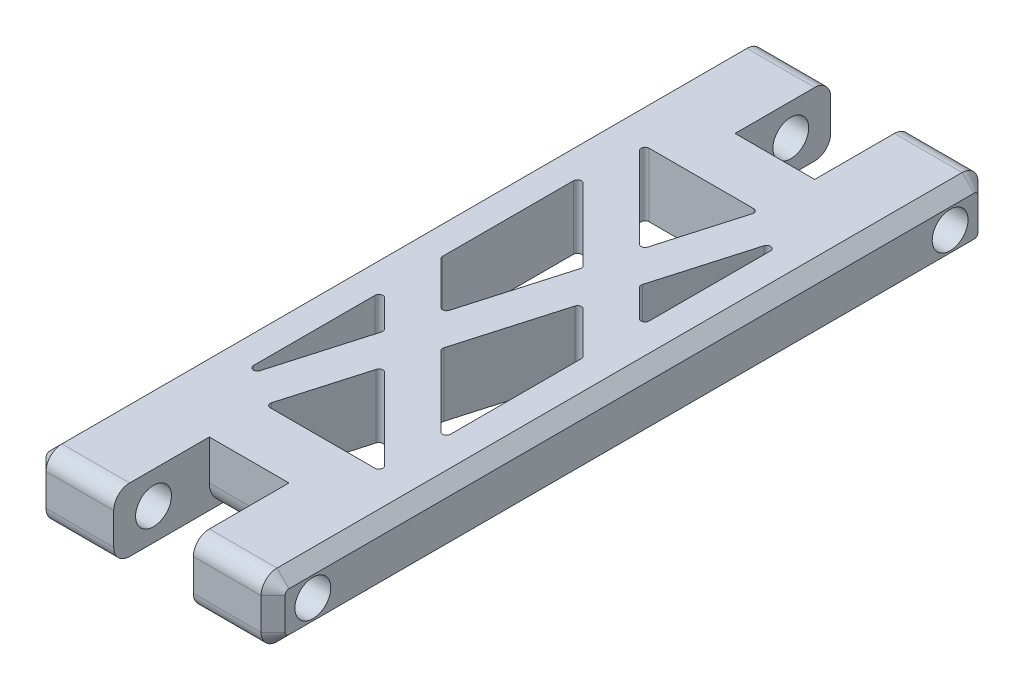
from build123d import *

# Parameters (mm, degrees)
SKETCH1_W           = 30
SKETCH1_H           = 90
BOSS_EXTRUDE1_DEPTH = 8
SKETCH2_W           = 10
SKETCH2_H           = 12
CUT_EXTRUDE1_DEPTH  = 8
SKETCH3_R           = 2.25
CUT_EXTRUDE2_DEPTH  = 55.671747731
FILLET1_R           = 2
CUT_EXTRUDE3_DEPTH  = 49.104053883
FILLET2_R           = 3
CHAMFER1_SIZE       = 1.5
FILLET3_R           = 0.5


with BuildPart() as part:
    # Sketch1 → Boss-Extrude1 (new body)
    with BuildSketch(Plane(origin=(0, 0, 0), x_dir=(1, 0, 0), z_dir=(0, 1, 0))):
        Rectangle(SKETCH1_W, SKETCH1_H)
    extrude(amount=BOSS_EXTRUDE1_DEPTH)

    # Sketch2 → Cut-Extrude1 (cut)
    with BuildSketch(Plane(origin=(0, 8, 0), x_dir=(1, 0, 0), z_dir=(0, 1, 0))):
        with Locations((0, 39)):
            Rectangle(SKETCH2_W, SKETCH2_H)
        with Locations((0, -39)):
            Rectangle(SKETCH2_W, SKETCH2_H)
    extrude(amount=-CUT_EXTRUDE1_DEPTH, mode=Mode.SUBTRACT)

    # Sketch3 → Cut-Extrude2 (cut, through all)
    with BuildSketch(Plane(origin=(15, 0, 0), x_dir=(0, 0, -1), z_dir=(1, 0, 0))):
        with Locations((-40, 4)):
            Circle(SKETCH3_R)
    cut_extrude2 = extrude(amount=-CUT_EXTRUDE2_DEPTH, mode=Mode.SUBTRACT)

    # Mirror1: Cut-Extrude2 across plane
    add(cut_extrude2.mirror(Plane.XY), mode=Mode.SUBTRACT)

    # Fillet1
    fillet1_edges = [part.edges().sort_by_distance(p)[0] for p in [
        (10, 0, 45),
        (-10, 0, -45),
        (-10, 8, 45),
        (-10, 8, -45),
        (10, 8, 45),
        (-10, 0, 45),
        (10, 0, -45),
        (10, 8, -45),
    ]]
    fillet(fillet1_edges, radius=FILLET1_R)

    # Sketch4 → Cut-Extrude3 (cut, through all)
    with BuildSketch(Plane(origin=(0, 8, 0), x_dir=(1, 0, 0), z_dir=(0, 1, 0))):
        Polygon((5, 26), (-10, 26), (1.641791045, 14.358208955), align=None)
        Polygon((10, 6), (10, 26), (5.52238806, 10.47761194), align=None)
        Polygon((-10, -6), (-10, -26), (-5.52238806, -10.47761194), align=None)
        Polygon((-5, -26), (10, -26), (-1.641791045, -14.358208955), align=None)
        Polygon((-10, 18.928932188), (-10, 1.071067812), (-3.939313176, -4.989619012), (0.058716162, 8.870216027), align=None)
        Polygon((9.840778775, -18.769710963), (9.840778775, -0.911846587), (3.939313176, 4.989619012), (-0.058716162, -8.870216027), align=None)
    extrude(amount=-CUT_EXTRUDE3_DEPTH, mode=Mode.SUBTRACT)

    # Fillet2
    fillet2_edges = [part.edges().sort_by_distance(p)[0] for p in [
        (0, 0, -33),
        (0, 0, 33),
    ]]
    fillet(fillet2_edges, radius=FILLET2_R)

    # Chamfer1
    chamfer1_edges = [part.edges().sort_by_distance(p)[0] for p in [
        (15, 4, -45),
        (15, 0, 0),
        (-15, 0, 0),
        (15, 8, 0),
        (15, 4, 45),
        (15, 7.414213562, 44.414213562),
        (15, 0.585786438, 44.414213562),
        (15, 7.414213562, -44.414213562),
        (15, 0.585786438, -44.414213562),
        (-15, 8, 0),
        (-15, 4, 45),
        (-15, 4, -45),
        (-15, 0.585786438, 44.414213562),
        (-15, 7.414213562, 44.414213562),
        (-15, 0.585786438, -44.414213562),
        (-15, 7.414213562, -44.414213562),
    ]]
    chamfer(chamfer1_edges, length=CHAMFER1_SIZE)

    # Fillet3
    fillet3_edges = [part.edges().sort_by_distance(p)[0] for p in [
        (-10, 4, -18.928932188),
        (0.058716162, 4, -8.870216027),
        (-3.939313176, 4, 4.989619012),
        (-10, 4, -1.071067812),
        (-1.641791045, 4, 14.358208955),
        (10, 4, 26),
        (-5, 4, 26),
        (10, 4, -6),
        (5.52238806, 4, -10.47761194),
        (10, 4, -26),
        (-10, 4, 6),
        (-5.52238806, 4, 10.47761194),
        (-10, 4, 26),
        (9.840778775, 4, 18.769710963),
        (-0.058716162, 4, 8.870216027),
        (3.939313176, 4, -4.989619012),
        (9.840778775, 4, 0.911846587),
        (5, 4, -26),
        (1.641791045, 4, -14.358208955),
        (-10, 4, -26),
    ]]
    fillet(fillet3_edges, radius=FILLET3_R)


solid = part.part
